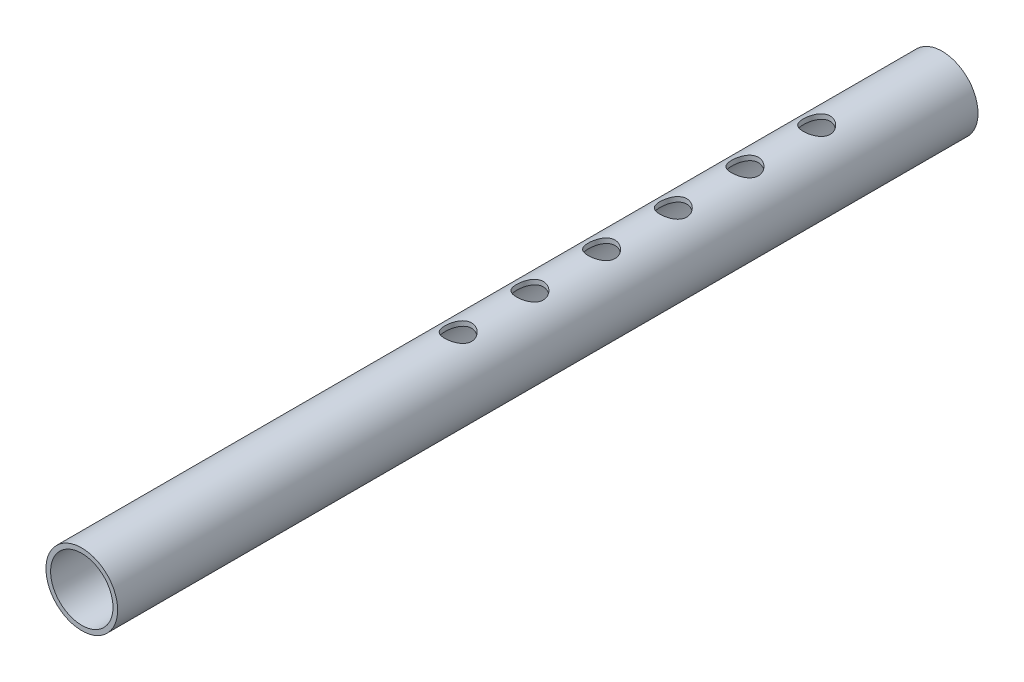
from build123d import *

# Parameters (mm, degrees)
SKETCH3_R               = 12.7
SKETCH3_R_2             = 11.049
BOSS_EXTRUDE1_DEPTH     = 304.8
CUT_EXTRUDE1_DEPTH      = 306.328708116
CUT_EXTRUDE1_DEPTH_BACK = 306.328708116
SKETCH4_R               = 4.7625


with BuildPart() as part:
    # Sketch3 → Boss-Extrude1 (new body)
    with BuildSketch(Plane.XY):
        Circle(SKETCH3_R)
        Circle(SKETCH3_R_2, mode=Mode.SUBTRACT)
    extrude(amount=BOSS_EXTRUDE1_DEPTH)

    # Sketch4 → Cut-Extrude1 (cut, two sides: drawn at the far end of the back side and taken through both)
    with BuildSketch(Plane(origin=(0, 0, 0), x_dir=(1, 0, 0), z_dir=(0, 1, 0)).offset(-CUT_EXTRUDE1_DEPTH_BACK)):
        with Locations(Location((0, -44.45, 0), (0, 0, 270))):
            Circle(SKETCH4_R)
        with Locations(Location((0, -69.85, 0), (0, 0, 270))):
            Circle(SKETCH4_R)
        with Locations(Location((0, -95.25, 0), (0, 0, 270))):
            Circle(SKETCH4_R)
        with Locations(Location((0, -120.65, 0), (0, 0, 270))):
            Circle(SKETCH4_R)
        with Locations(Location((0, -146.05, 0), (0, 0, 270))):
            Circle(SKETCH4_R)
        with Locations(Location((0, -171.45, 0), (0, 0, 270))):
            Circle(SKETCH4_R)
    extrude(amount=CUT_EXTRUDE1_DEPTH + CUT_EXTRUDE1_DEPTH_BACK, mode=Mode.SUBTRACT)


solid = part.part
